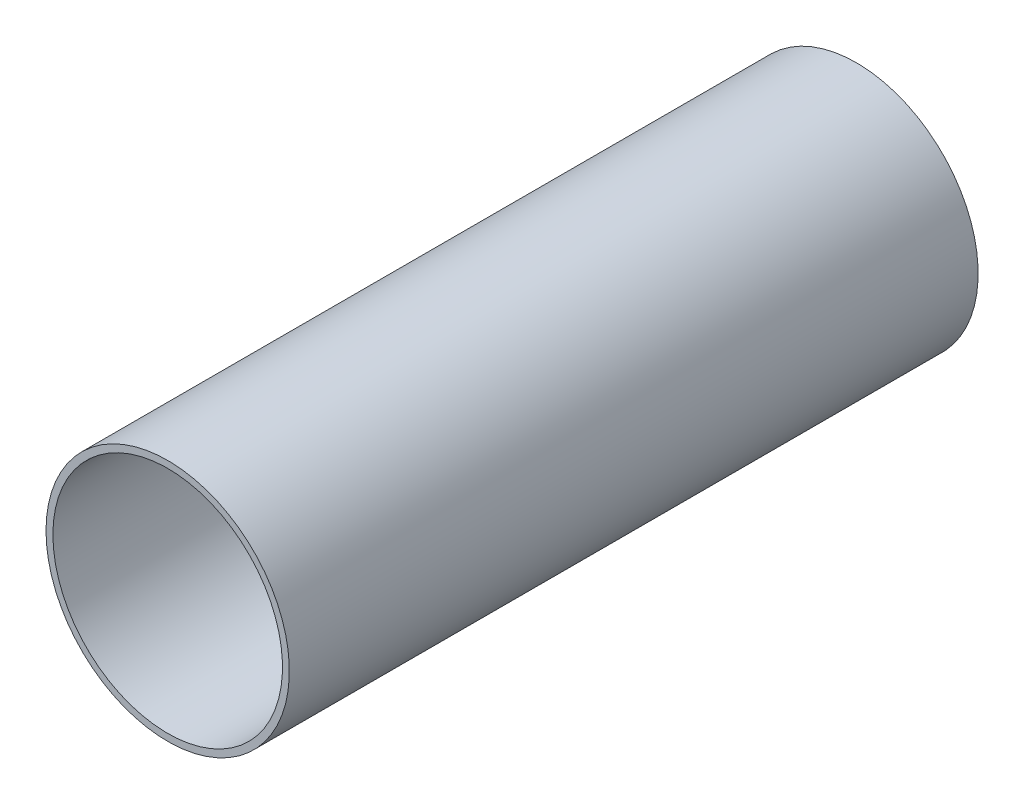
from build123d import *

# Parameters (mm, degrees)
SKETCH1_R           = 13.462
SKETCH1_R_2         = 12.7
BOSS_EXTRUDE1_DEPTH = 76.2


with BuildPart() as part:
    # Sketch1 → Boss-Extrude1 (new body)
    with BuildSketch(Plane.XY):
        with Locations(Location((0, 0, 0), (0, 0, 180))):
            Circle(SKETCH1_R)
        with Locations(Location((0, 0, 0), (0, 0, 180))):
            Circle(SKETCH1_R_2, mode=Mode.SUBTRACT)
    extrude(amount=BOSS_EXTRUDE1_DEPTH)


solid = part.part
